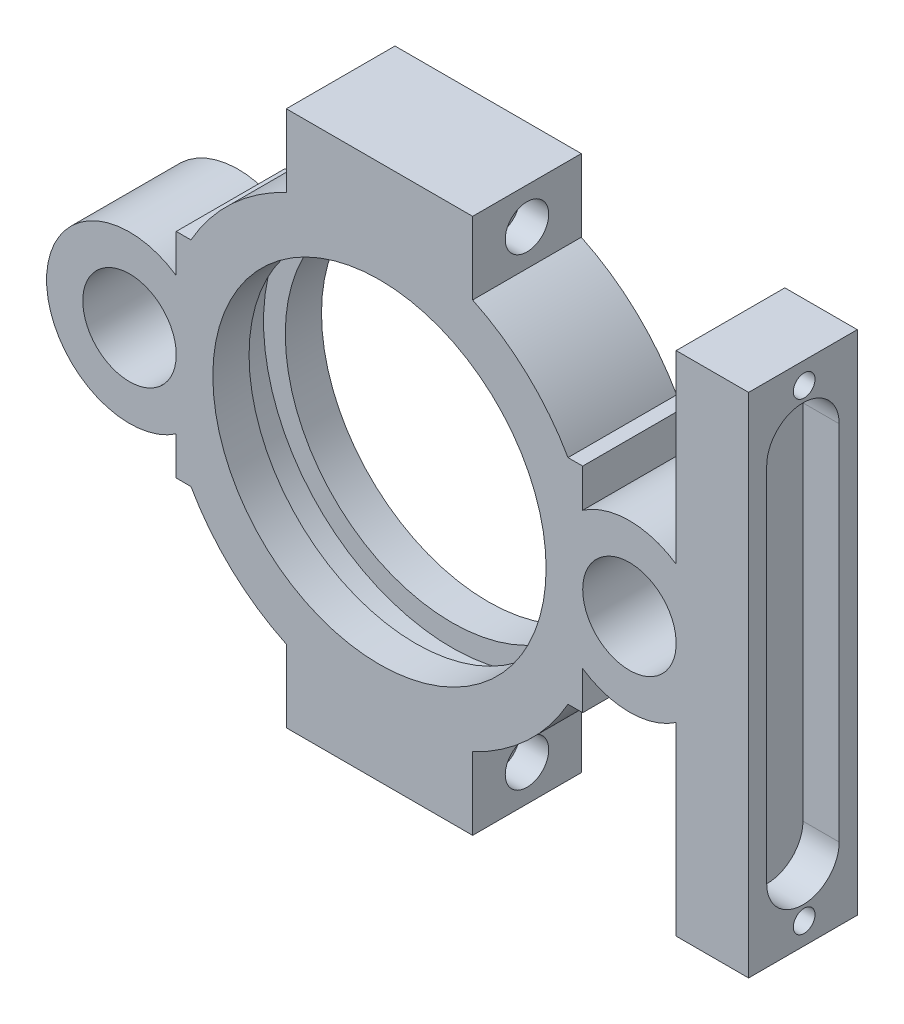
from build123d import *
from build123d.topology import SkipClean

# Parameters (mm, degrees)
SKETCH1_R           = 6.45
BOSS_EXTRUDE1_DEPTH = 15
SKETCH2_W           = 5
SKETCH2_H           = 3
CUT_EXTRUDE3_DEPTH  = 5
SKETCH4_R           = 1.5
CUT_EXTRUDE4_DEPTH  = 56.180796325
SKETCH5_R           = 3
CUT_EXTRUDE5_DEPTH  = 4
CUT_EXTRUDE6_START  = -80
CUT_EXTRUDE6_DEPTH  = 80


with BuildPart() as part:
    # Sketch1 → Boss-Extrude1 (new body)
    with BuildSketch(Plane.XY):
        with BuildLine():
            Line((0, 23), (0, 37))
            Line((0, 37), (12.859510911, 37))
            Line((12.859510911, 37), (12.859510911, 27))
            ThreePointArc((12.859510911, 27), (20.383390121, 21.88342816), (26.020458433, 14.741192754))
            Line((26.020458433, 14.741192754), (28.050458433, 14.741192754))
            Line((28.050458433, 14.741192754), (28.050458433, 9.460443964))
            ThreePointArc((28.050458433, 9.460443964), (34.500458433, 11.45), (40.950458433, 9.460443964))
            Line((40.950458433, 9.460443964), (40.950458433, 35))
            Line((40.950458433, 35), (50.950458433, 35))
            Line((50.950458433, 35), (50.950458433, -35))
            Line((50.950458433, -35), (40.950458433, -35))
            Line((40.950458433, -35), (40.950458433, -9.460443964))
            ThreePointArc((40.950458433, -9.460443964), (34.500458433, -11.45), (28.050458433, -9.460443964))
            Line((28.050458433, -9.460443964), (28.050458433, -14.741192754))
            Line((28.050458433, -14.741192754), (26.020458433, -14.741192754))
            ThreePointArc((26.020458433, -14.741192754), (20.383390121, -21.88342816), (12.859510911, -27))
            Line((12.859510911, -27), (12.859510911, -37))
            Line((12.859510911, -37), (0, -37))
            Line((0, -37), (0, -23))
            ThreePointArc((0, -23), (23, 0), (0, 23))
        make_face()
        with Locations(Location((34.500458433, 0, 0), (0, 0, 180))):
            Circle(SKETCH1_R, mode=Mode.SUBTRACT)
    boss_extrude1 = extrude(amount=BOSS_EXTRUDE1_DEPTH)

    # Sketch2 → Cut-Revolve1 (revolve, cut)
    with BuildSketch(Plane.ZY):
        with Locations((7.5, 24.5)):
            Rectangle(SKETCH2_W, SKETCH2_H)
    cut_revolve1 = revolve(axis=Axis((0, 0, 15), (0, 0, -1)), mode=Mode.SUBTRACT)

    # Sketch3 → Cut-Extrude3 (cut)
    with BuildSketch(Plane(origin=(50.950458433, 0, 0), x_dir=(0, 0, -1), z_dir=(1, 0, 0))):
        with BuildLine():
            Line((-12.5, -25), (-12.5, 25))
            ThreePointArc((-12.5, 25), (-7.5, 30), (-2.5, 25))
            Line((-2.5, 25), (-2.5, -25))
            ThreePointArc((-2.5, -25), (-7.5, -30), (-12.5, -25))
        make_face()
    extrude(amount=-CUT_EXTRUDE3_DEPTH, mode=Mode.SUBTRACT)

    # Sketch4 → Cut-Extrude4 (cut, symmetric)
    with BuildSketch(Plane(origin=(12.859510911, 0, 0), x_dir=(0, 0, -1), z_dir=(1, 0, 0))):
        with Locations((-7.333431897, 32)):
            Circle(SKETCH4_R)
        with Locations((-7.333431897, -32)):
            Circle(SKETCH4_R)
    cut_extrude4 = extrude(amount=CUT_EXTRUDE4_DEPTH, both=True, mode=Mode.SUBTRACT)

    # Sketch5 → Cut-Extrude5 (cut)
    with BuildSketch(Plane(origin=(12.859510911, 0, 0), x_dir=(0, 0, -1), z_dir=(1, 0, 0))):
        with Locations((-7.5, 32)):
            Circle(SKETCH5_R)
        with Locations(Location((-7.5, -32, 0), (0, 0, 180))):
            Circle(SKETCH5_R)
    cut_extrude5 = extrude(amount=-CUT_EXTRUDE5_DEPTH, mode=Mode.SUBTRACT)

    # Mirror1: Boss-Extrude1, Cut-Revolve1, Cut-Extrude4, Cut-Extrude5 across plane
    add(boss_extrude1.mirror(Plane.ZY))
    add(cut_revolve1.mirror(Plane.ZY), mode=Mode.SUBTRACT)
    add(cut_extrude4.mirror(Plane.ZY), mode=Mode.SUBTRACT)
    add(cut_extrude5.mirror(Plane.ZY), mode=Mode.SUBTRACT)

    # Sketch6 → Cut-Extrude6 (cut)
    with SkipClean():  # the faces are left unmerged after this step: merging them gives an invalid solid
        with BuildSketch(Plane.XY.offset(15).offset(CUT_EXTRUDE6_START)):
            with BuildLine():
                Line((-40.950458433, 9.460443964), (-40.950458433, 38.741811421))
                Line((-40.950458433, 38.741811421), (-62.772471418, 38.741811421))
                Line((-62.772471418, 38.741811421), (-62.772471418, -39.471412389))
                Line((-62.772471418, -39.471412389), (-40.950458433, -39.471412389))
                Line((-40.950458433, -39.471412389), (-40.950458433, -9.460443964))
                ThreePointArc((-40.950458433, -9.460443964), (-45.950458433, 0), (-40.950458433, 9.460443964))
            make_face()
        extrude(amount=CUT_EXTRUDE6_DEPTH, mode=Mode.SUBTRACT)


solid = part.part
